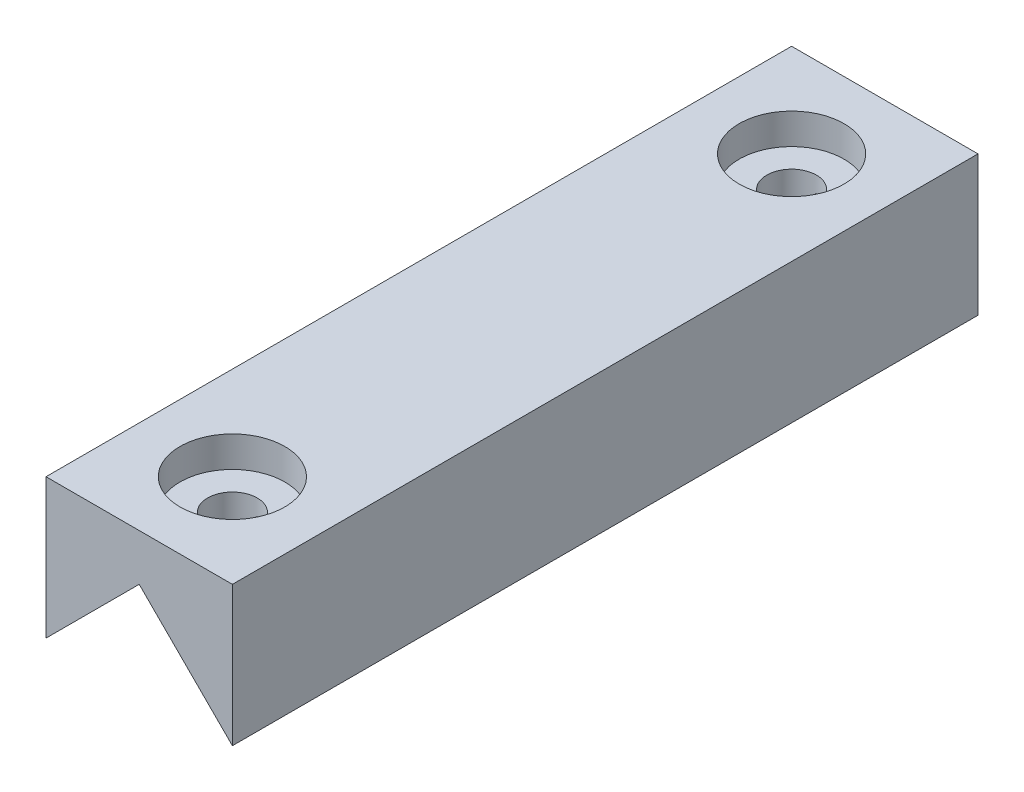
from build123d import *

# Parameters (mm, degrees)
BOSS_EXTRUDE1_DEPTH                                  = 101.6
CBORE_FOR_1_4_BINDING_HEAD_MACHINE_SCREW_D           = 6.7564
CBORE_FOR_1_4_BINDING_HEAD_MACHINE_SCREW_CBORE_D     = 14.2875
CBORE_FOR_1_4_BINDING_HEAD_MACHINE_SCREW_CBORE_DEPTH = 4.191


with BuildPart() as part:
    # Sketch1 → Boss-Extrude1 (new body)
    with BuildSketch(Plane.XY):
        Polygon((0, -19.05), (12.7, -6.35), (25.4, -19.05), (25.4, 0), (0, 0), align=None)
    extrude(amount=BOSS_EXTRUDE1_DEPTH)

    # CBORE for 1/4 Binding Head Machine Screw1 (through all)
    with Locations(Plane(origin=(0, 0, 0), x_dir=(1, 0, 0), z_dir=(0, 1, 0))):
        with Locations((12.7, -88.9), (12.7, -12.7)):
            CounterBoreHole(CBORE_FOR_1_4_BINDING_HEAD_MACHINE_SCREW_D / 2, CBORE_FOR_1_4_BINDING_HEAD_MACHINE_SCREW_CBORE_D / 2, CBORE_FOR_1_4_BINDING_HEAD_MACHINE_SCREW_CBORE_DEPTH)


solid = part.part
